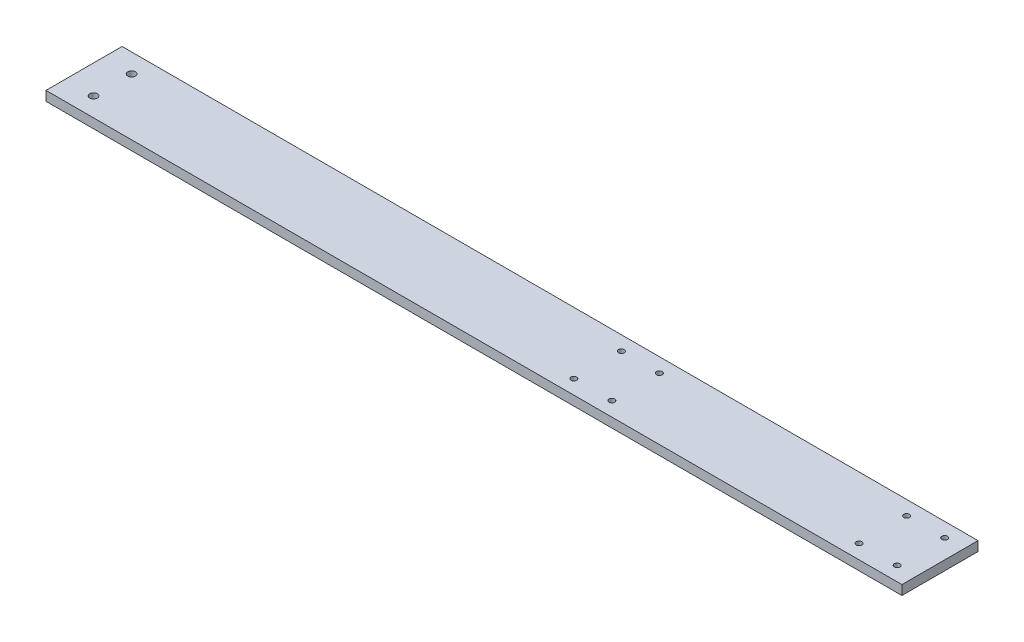
from build123d import *

# Parameters (mm, degrees)
SKETCH_1_W      = 450
SKETCH_1_H      = 40
SKETCH_1_R      = 1.5
SKETCH_1_R_2    = 2
EXTRUDE_1_DEPTH = 5
CHAMFER_1_SIZE  = 2


with BuildPart() as part:
    # 草图1 → 凸台-拉伸1 (new body)
    with BuildSketch(Plane(origin=(0, 0, 0), x_dir=(1, 0, 0), z_dir=(0, 1, 0))):
        Rectangle(SKETCH_1_W, SKETCH_1_H)
        with Locations(Location((215, 12.5, 0), (0, 0, 270))):
            Circle(SKETCH_1_R, mode=Mode.SUBTRACT)
        with Locations(Location((195, 12.5, 0), (0, 0, 270))):
            Circle(SKETCH_1_R, mode=Mode.SUBTRACT)
        with Locations(Location((195, -12.5, 0), (0, 0, 90))):
            Circle(SKETCH_1_R, mode=Mode.SUBTRACT)
        with Locations(Location((215, -12.5, 0), (0, 0, 90))):
            Circle(SKETCH_1_R, mode=Mode.SUBTRACT)
        with Locations(Location((65, -12.5, 0), (0, 0, 90))):
            Circle(SKETCH_1_R, mode=Mode.SUBTRACT)
        with Locations(Location((45, 12.5, 0), (0, 0, 270))):
            Circle(SKETCH_1_R, mode=Mode.SUBTRACT)
        with Locations(Location((65, 12.5, 0), (0, 0, 270))):
            Circle(SKETCH_1_R, mode=Mode.SUBTRACT)
        with Locations(Location((45, -12.5, 0), (0, 0, 90))):
            Circle(SKETCH_1_R, mode=Mode.SUBTRACT)
        with Locations(Location((-210, 10, 0), (0, 0, 270))):
            Circle(SKETCH_1_R_2, mode=Mode.SUBTRACT)
        with Locations(Location((-210, -10, 0), (0, 0, 270))):
            Circle(SKETCH_1_R_2, mode=Mode.SUBTRACT)
    extrude(amount=EXTRUDE_1_DEPTH)

    # 倒角1
    chamfer_1_edges = [part.edges().sort_by_distance(p)[0] for p in [
        (215, 0, -14),
        (195, 0, -14),
        (195, 0, 14),
        (215, 0, 14),
        (65, 0, -14),
        (45, 0, -14),
        (45, 0, 14),
        (65, 0, 14),
    ]]
    chamfer(chamfer_1_edges, length=CHAMFER_1_SIZE)


solid = part.part
